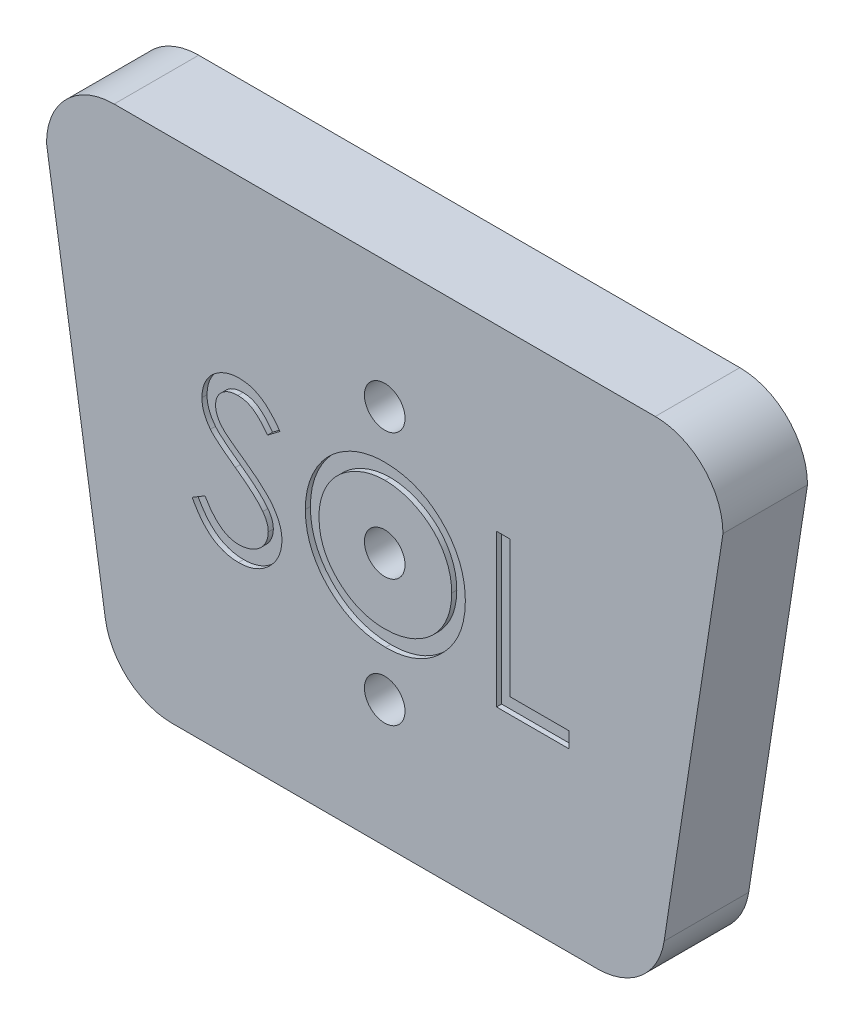
from build123d import *

# Parameters (mm, degrees)
BOSS_EXTRUDE1_DEPTH = 25
FILLET2_R           = 20
SKETCH10_R          = 6
CUT_EXTRUDE6_DEPTH  = 12
SKETCH11_R          = 3.2
CUT_EXTRUDE7_DEPTH  = 251.33777182
CUT_EXTRUDE8_DEPTH  = 1.5


with BuildPart() as part:
    # Sketch2 → Boss-Extrude1 (new body)
    with BuildSketch(Plane.XY):
        with BuildLine():
            Line((0, -20), (20, -150))
            Line((20, -150), (40, -150))
            Line((40, -150), (160, -150))
            Line((160, -150), (180, -150))
            Line((180, -150), (200, -20))
            ThreePointArc((200, -20), (194.142135624, -5.857864376), (180, 0))
            Line((180, 0), (160, 0))
            Line((160, 0), (40, 0))
            Line((40, 0), (20, 0))
            ThreePointArc((20, 0), (5.857864376, -5.857864376), (0, -20))
        make_face()
    extrude(amount=BOSS_EXTRUDE1_DEPTH)

    # Fillet2
    fillet2_edges = [part.edges().sort_by_distance(p)[0] for p in [
        (180, -150, 12.5),
        (20, -150, 12.5),
    ]]
    fillet(fillet2_edges, radius=FILLET2_R)

    # Sketch10 → Cut-Extrude6 (cut)
    with BuildSketch(Plane.XY.offset(25)):
        with Locations((100, -75)):
            Circle(SKETCH10_R)
        with Locations((100, -112.5)):
            Circle(SKETCH10_R)
        with Locations((100, -37.5)):
            Circle(SKETCH10_R)
    extrude(amount=-CUT_EXTRUDE6_DEPTH, mode=Mode.SUBTRACT)

    # Sketch11 → Cut-Extrude7 (cut, through all)
    with BuildSketch(Plane.XY.offset(13)):
        with Locations((100, -37.5)):
            Circle(SKETCH11_R)
        with Locations((100, -75)):
            Circle(SKETCH11_R)
        with Locations((100, -112.5)):
            Circle(SKETCH11_R)
    extrude(amount=-CUT_EXTRUDE7_DEPTH, mode=Mode.SUBTRACT)

    # Sketch13 → Cut-Extrude8 (cut)
    # profile 1 of 3: a face of its own
    with BuildSketch(Plane.XY.offset(25)):
        with BuildLine():
            Line((43.067502305, -89.17305103), (46.871588843, -86.892401992))
            add(Edge.make_bspline(
                [(46.871588843, -86.892401992), (47.225394751, -87.48465837), (47.903273216, -88.619398734), (49.034076405, -90.152716397), (50.205785263, -91.455944127), (51.427076694, -92.521500509), (52.690496027, -93.360414768), (54.004291004, -93.954443461), (55.364034284, -94.324934573), (56.289411989, -94.369935686), (56.751396536, -94.392401992)],
                knots=[0, 0, 0, 0, 1.272034388, 2.437168799, 3.508375237, 4.49857839, 5.41946034, 6.295179144, 7.148887113, 8, 8, 8, 8], degree=3))
            add(Edge.make_bspline(
                [(56.751396536, -94.392401992), (57.145941885, -94.381413345), (57.928128967, -94.359628328), (59.079643519, -94.15030373), (60.197980977, -93.828719215), (61.260092034, -93.368164382), (62.251321363, -92.810955279), (63.120550303, -92.137932997), (63.87200033, -91.384424638), (64.486688946, -90.543790507), (64.9582894, -89.639712882), (65.320758851, -88.711736365), (65.521909798, -87.745283344), (65.552210913, -87.094577393), (65.567502305, -86.766200069)],
                knots=[0, 0, 0, 0, 1.095163259, 2.171163733, 3.241058638, 4.321873601, 5.38011039, 6.391990106, 7.366004449, 8.327778327, 9.272591725, 10.192022065, 11.087607919, 12, 12, 12, 12], degree=3))
            add(Edge.make_bspline(
                [(65.567502305, -86.766200069), (65.548546882, -86.391532001), (65.510013276, -85.629886569), (65.184322818, -84.506176746), (64.671975358, -83.394129417), (64.199312797, -82.706256002), (63.953920574, -82.349132761)],
                knots=[0, 0, 0, 0, 0.938893495, 1.908633276, 2.914225137, 4, 4, 4, 4], degree=3))
            add(Edge.make_bspline(
                [(63.953920574, -82.349132761), (63.752441249, -82.091387886), (63.329460608, -81.550284762), (62.602292589, -80.74484602), (61.749013976, -79.914037776), (60.798825413, -79.026135616), (59.717114271, -78.122435372), (58.537760514, -77.159843227), (57.230653756, -76.174965808), (56.313945943, -75.514461394), (55.840939805, -75.173651992)],
                knots=[0, 0, 0, 0, 0.722233717, 1.516239348, 2.393582979, 3.351407094, 4.387010283, 5.505090956, 6.712668013, 8, 8, 8, 8], degree=3))
            add(Edge.make_bspline(
                [(55.840939805, -75.173651992), (55.367488425, -74.836427294), (54.462285441, -74.191679351), (53.196389382, -73.234795699), (52.064389143, -72.359945948), (51.071316074, -71.558894364), (50.217606971, -70.831532303), (49.496534544, -70.184844514), (48.926467381, -69.601341589), (48.609467059, -69.222810052), (48.467141728, -69.052858723)],
                knots=[0, 0, 0, 0, 1.452282411, 2.77665338, 3.964542531, 5.026858415, 5.96415736, 6.766646006, 7.446254459, 8, 8, 8, 8], degree=3))
            add(Edge.make_bspline(
                [(48.467141728, -69.052858723), (48.268209003, -68.787988249), (47.876981103, -68.267084915), (47.360561033, -67.452908172), (46.921628939, -66.619466188), (46.577541812, -65.764519358), (46.287790427, -64.900070272), (46.092902746, -64.014839971), (45.9708705, -63.11280059), (45.95837353, -62.505769868), (45.952117689, -62.201897184)],
                knots=[0, 0, 0, 0, 1.068054152, 2.10047183, 3.106115577, 4.101338837, 5.06977816, 6.043150881, 7.020423561, 8, 8, 8, 8], degree=3))
            add(Edge.make_bspline(
                [(45.952117689, -62.201897184), (45.968898948, -61.725800083), (46.002102777, -60.78378212), (46.282909428, -59.407671443), (46.726132346, -58.093846079), (47.347066619, -56.855313217), (48.147518299, -55.724322034), (49.073823684, -54.687862916), (50.177114221, -53.816552573), (51.387647949, -53.055254679), (52.712658447, -52.459378498), (54.101112919, -52.009880182), (55.555218131, -51.755189726), (56.540115576, -51.718639891), (57.039858074, -51.7000943)],
                knots=[0, 0, 0, 0, 1.005424448, 1.989358655, 2.955360095, 3.929531133, 4.905563448, 5.876582895, 6.856512386, 7.866279853, 8.892233794, 9.918561126, 10.94386622, 12, 12, 12, 12], degree=3))
            add(Edge.make_bspline(
                [(57.039858074, -51.7000943), (57.570139364, -51.718384249), (58.6246996, -51.75475712), (60.1759038, -52.071011094), (61.669398726, -52.594305446), (62.87081213, -53.18815962), (63.811090492, -53.781277822), (64.528168484, -54.321532705), (65.254821423, -54.943498387), (65.996910699, -55.648831551), (66.741862035, -56.444004065), (67.500734992, -57.323570066), (68.275304162, -58.282154355), (68.773593793, -58.966469365), (69.029040766, -59.3172818)],
                knots=[0, 0, 0, 0, 1.286793592, 2.559021753, 3.825965368, 5.121522368, 5.803751409, 6.523245864, 7.299691795, 8.125521123, 9.008227632, 9.944561021, 10.946284179, 12, 12, 12, 12], degree=3))
            Line((69.029040766, -59.3172818), (65.37819942, -62.084709684))
            add(Edge.make_bspline(
                [(65.37819942, -62.084709684), (65.157751717, -61.800712236), (64.733220983, -61.253799552), (64.088699009, -60.487882637), (63.481216393, -59.788242186), (62.882711253, -59.180547682), (62.324793134, -58.631520254), (61.783288305, -58.161466237), (61.265989504, -57.76578001), (60.613914938, -57.343505668), (59.794687131, -56.924922051), (58.766314522, -56.570719619), (57.691633843, -56.357868822), (56.959681439, -56.329725982), (56.58913692, -56.315478915)],
                knots=[0, 0, 0, 0, 1.181633172, 2.275549214, 3.290209073, 4.226197932, 5.078386478, 5.862611352, 6.581680152, 7.217281963, 8.414376989, 9.595101626, 10.782541182, 12, 12, 12, 12], degree=3))
            add(Edge.make_bspline(
                [(56.58913692, -56.315478915), (56.124267346, -56.331057914), (55.227810165, -56.361100547), (53.955078558, -56.689214644), (52.809585236, -57.205838562), (51.825337971, -57.92988828), (51.005862552, -58.787729615), (50.413078082, -59.774886323), (50.056290252, -60.864945785), (50.012752371, -61.625338509), (49.990579228, -62.0125943)],
                knots=[0, 0, 0, 0, 1.14458467, 2.207223713, 3.21896685, 4.227309161, 5.202851033, 6.127160689, 7.046193047, 8, 8, 8, 8], degree=3))
            add(Edge.make_bspline(
                [(49.990579228, -62.0125943), (49.995633713, -62.253684738), (50.005750949, -62.736259845), (50.146855491, -63.449206699), (50.328132577, -64.160352491), (50.615394985, -64.866499985), (51.01197746, -65.579998887), (51.532758294, -66.313135513), (52.188643734, -67.072371767), (52.691062464, -67.566180858), (52.95632442, -67.826897184)],
                knots=[0, 0, 0, 0, 0.858281714, 1.717966888, 2.583508476, 3.4729293, 4.427298488, 5.488583878, 6.674047936, 8, 8, 8, 8], degree=3))
            add(Edge.make_bspline(
                [(52.95632442, -67.826897184), (53.05482778, -67.914801802), (53.288849214, -68.123643052), (53.716682545, -68.465543803), (54.28166138, -68.887293732), (54.969032538, -69.409130659), (55.791470046, -70.014463743), (56.749064339, -70.695553042), (57.83114119, -71.474508944), (58.598994394, -72.019105894), (59.005002305, -72.307065453)],
                knots=[0, 0, 0, 0, 0.420754252, 0.999615792, 1.744751191, 2.668019286, 3.750313428, 4.999500688, 6.413464383, 8, 8, 8, 8], degree=3))
            add(Edge.make_bspline(
                [(59.005002305, -72.307065453), (59.493392619, -72.662454362), (60.439092772, -73.350615727), (61.784690228, -74.384531613), (63.004753475, -75.395717209), (64.103566092, -76.377715015), (65.091983487, -77.323076211), (65.959039895, -78.243174243), (66.713570071, -79.131417321), (67.525874309, -80.27020758), (68.355903417, -81.66882152), (69.068722798, -83.382398873), (69.518187265, -85.102637279), (69.576963892, -86.258839463), (69.605963843, -86.82930103)],
                knots=[0, 0, 0, 0, 1.163667725, 2.253281268, 3.268753668, 4.215851969, 5.092017293, 5.902905408, 6.650798638, 7.335211899, 8.59617414, 9.77448103, 10.901945474, 12, 12, 12, 12], degree=3))
            add(Edge.make_bspline(
                [(69.605963843, -86.82930103), (69.597514925, -87.232737153), (69.580781159, -88.031774941), (69.388426554, -89.205054501), (69.106602287, -90.344594254), (68.681837851, -91.436308557), (68.163397245, -92.500169792), (67.505545486, -93.508271369), (66.743018111, -94.482925065), (65.868298277, -95.398141382), (64.911136675, -96.238306759), (63.899489173, -96.985680407), (62.831699949, -97.608844564), (61.713561592, -98.117355391), (60.544817263, -98.515072045), (59.325860042, -98.803237505), (58.054680612, -98.980096645), (57.19067442, -98.998453578), (56.751396536, -99.007786607)],
                knots=[0, 0, 0, 0, 0.983748083, 1.948392443, 2.894712957, 3.844097841, 4.80183111, 5.778335162, 6.776009319, 7.81870978, 8.863265674, 9.881300176, 10.883814829, 11.87499822, 12.874611388, 13.892143829, 14.928324115, 16, 16, 16, 16], degree=3))
            add(Edge.make_bspline(
                [(56.751396536, -99.007786607), (56.411513554, -99.001214272), (55.736028068, -98.988152375), (54.736906158, -98.872678769), (53.757968583, -98.709301723), (52.811499242, -98.449920823), (51.88530395, -98.135216833), (50.983410934, -97.747723985), (50.105383099, -97.283359966), (49.246299891, -96.752423936), (48.408346218, -96.134538648), (47.59938163, -95.414879408), (46.79286353, -94.613294344), (46.012597006, -93.708015672), (45.242799437, -92.713668893), (44.498648457, -91.620950821), (43.764740658, -90.435813415), (43.304256072, -89.601833742), (43.067502305, -89.17305103)],
                knots=[0, 0, 0, 0, 0.915332311, 1.819136955, 2.706846663, 3.586547465, 4.459518054, 5.340707479, 6.227863349, 7.133153174, 8.059268498, 9.028702269, 10.047606654, 11.120612155, 12.245963614, 13.433783089, 14.680604001, 16, 16, 16, 16], degree=3))
        make_face()
    # profile 2 of 3: a face of its own
    with BuildSketch(Plane.XY.offset(25)):
        with BuildLine():
            add(Edge.make_bspline(
                [(99.894425382, -51.7000943), (100.727672458, -51.721199034), (102.364238461, -51.762650475), (104.769487146, -52.079953235), (107.0657098, -52.628893963), (109.271611585, -53.359989452), (111.360806998, -54.335260121), (113.34902133, -55.514069171), (115.231523993, -56.908766498), (116.982941756, -58.508570843), (118.585673974, -60.249215251), (119.997721083, -62.10678838), (121.181122002, -64.070058695), (122.152939266, -66.133126518), (122.915349962, -68.291326106), (123.441451952, -70.556163284), (123.777513883, -72.912963585), (123.816802449, -74.520451846), (123.836733074, -75.335911607)],
                knots=[0, 0, 0, 0, 1.065120563, 2.091984664, 3.0946048, 4.079830382, 5.057816894, 6.036188127, 7.030412546, 8.04752943, 9.064399622, 10.05169764, 11.02544977, 11.989514704, 12.962713494, 13.945757189, 14.957906945, 16, 16, 16, 16], degree=3))
            add(Edge.make_bspline(
                [(123.836733074, -75.335911607), (123.81680537, -76.145364489), (123.777525557, -77.740889895), (123.441069846, -80.082734177), (122.913399846, -82.333900274), (122.160019281, -84.490630096), (121.192834558, -86.555198773), (120.001553786, -88.522173894), (118.598309648, -90.392200302), (117.001364421, -92.144791712), (115.26049388, -93.751902049), (113.393247593, -95.152287594), (111.441619194, -96.357312053), (109.380494375, -97.318816433), (107.237208187, -98.087312553), (104.992578319, -98.611274939), (102.657122624, -98.949251209), (101.064495432, -98.9880607), (100.255002305, -99.007786607)],
                knots=[0, 0, 0, 0, 1.043624062, 2.057103931, 3.04512605, 4.022047818, 4.998200453, 5.980619268, 6.982898556, 8.009068085, 9.034988726, 10.034168286, 11.015286542, 11.987931943, 12.962482838, 13.94673481, 14.956375938, 16, 16, 16, 16], degree=3))
            add(Edge.make_bspline(
                [(100.255002305, -99.007786607), (99.439546775, -98.987865919), (97.832066856, -98.94859694), (95.472304972, -98.611978878), (93.205876837, -98.085590687), (91.03926375, -97.333326507), (88.971257512, -96.361104969), (86.997813592, -95.175620095), (85.126853128, -93.768956851), (83.373887816, -92.172529464), (81.769969553, -90.434609509), (80.371634723, -88.572454801), (79.185883266, -86.62259893), (78.216926134, -84.579630763), (77.449811657, -82.4534265), (76.926463995, -80.229803218), (76.587858897, -77.921438143), (76.548839442, -76.349743736), (76.529040766, -75.552257761)],
                knots=[0, 0, 0, 0, 1.053102029, 2.075944431, 3.073151272, 4.055350789, 5.033113405, 6.020478099, 7.024410459, 8.052272461, 9.079885166, 10.07527673, 11.055994387, 12.023226415, 12.992069828, 13.970394897, 14.97016774, 16, 16, 16, 16], degree=3))
            add(Edge.make_bspline(
                [(76.529040766, -75.552257761), (76.535914651, -75.016980587), (76.549575704, -73.953178999), (76.714040322, -72.373465568), (76.952690766, -70.819157111), (77.294715356, -69.294673494), (77.742036789, -67.803746548), (78.269848569, -66.336093883), (78.914503724, -64.906588864), (79.643254913, -63.508459542), (80.456621016, -62.163500752), (81.355023509, -60.892191826), (82.306906818, -59.683864725), (83.350436165, -58.569831818), (84.451219031, -57.517684807), (85.627112465, -56.543592731), (86.870941321, -55.638771933), (88.188057632, -54.823367548), (89.54600688, -54.08589296), (90.945851166, -53.45304059), (92.368578514, -52.909876942), (93.820852559, -52.469637761), (95.298816771, -52.122083013), (96.805696859, -51.885417036), (98.340292339, -51.720532949), (99.374152154, -51.706936495), (99.894425382, -51.7000943)],
                knots=[0, 0, 0, 0, 1.037015668, 2.060948919, 3.074880161, 4.083647147, 5.086022904, 6.090072063, 7.104153813, 8.122640571, 9.144368836, 10.147691507, 11.138137339, 12.123020368, 13.103399296, 14.087645067, 15.080126199, 16.082011238, 17.087798457, 18.072939717, 19.057185487, 20.037253025, 21.01195951, 21.997135196, 22.992090687, 24, 24, 24, 24], degree=3))
        make_face()
        with BuildLine():
            add(Edge.make_bspline(
                [(100.092742689, -56.315478915), (99.665697401, -56.320684647), (98.815689406, -56.331046343), (97.552031083, -56.467534115), (96.304991934, -56.662061259), (95.07431442, -56.939537954), (93.865147842, -57.317590062), (92.666221313, -57.752687453), (91.488467763, -58.282672903), (90.335775305, -58.881464816), (89.218295767, -59.544236655), (88.163846749, -60.276730803), (87.169698469, -61.061769357), (86.238285041, -61.901184409), (85.372341399, -62.799250718), (84.554823808, -63.742353468), (83.818500616, -64.75744921), (83.143686057, -65.817011584), (82.539813825, -66.919660486), (82.002830692, -68.053787286), (81.563579151, -69.228643259), (81.205348598, -70.431482428), (80.90835103, -71.660399766), (80.720200578, -72.924717823), (80.582213099, -74.218083549), (80.572443658, -75.092135958), (80.567502305, -75.534228915)],
                knots=[0, 0, 0, 0, 1.008559885, 2.007477868, 2.99961109, 3.989939068, 4.984837346, 5.991145699, 7.001802488, 8.033829008, 9.059044045, 10.069351652, 11.065060232, 12.050310815, 13.029377138, 14.011219647, 14.996725999, 15.989392538, 16.977580475, 17.965360261, 18.951710183, 19.937753436, 20.929683414, 21.935841486, 22.955955122, 24, 24, 24, 24], degree=3))
            add(Edge.make_bspline(
                [(80.567502305, -75.534228915), (80.583893387, -76.184314611), (80.616139717, -77.463234286), (80.898451333, -79.337396136), (81.33330529, -81.138531246), (81.974328573, -82.856784365), (82.775979332, -84.506925145), (83.766325065, -86.074315062), (84.939656165, -87.559377732), (86.272472935, -88.951745476), (87.729479163, -90.222620102), (89.276614262, -91.338149642), (90.897303501, -92.281995711), (92.59577325, -93.05091807), (94.362955895, -93.660214699), (96.210238694, -94.077797099), (98.125316032, -94.352624383), (99.430710169, -94.379016959), (100.092742689, -94.392401992)],
                knots=[0, 0, 0, 0, 1.032063989, 2.030389145, 3.003944642, 3.970395727, 4.937377036, 5.913328081, 6.909231446, 7.93887556, 8.970685674, 9.976071282, 10.964166581, 11.944589148, 12.933237628, 13.927779006, 14.949070134, 16, 16, 16, 16], degree=3))
            add(Edge.make_bspline(
                [(100.092742689, -94.392401992), (100.537721996, -94.386288364), (101.420249606, -94.374163205), (102.732906322, -94.25203736), (104.021914759, -94.056199039), (105.285466929, -93.774233466), (106.522128789, -93.421340812), (107.737061972, -93.002098596), (108.917325705, -92.479054548), (110.077809334, -91.901152314), (111.188618156, -91.242350288), (112.249017857, -90.534716936), (113.232280455, -89.750834669), (114.162997087, -88.923891365), (115.032495946, -88.037213321), (115.834897171, -87.091953326), (116.567498871, -86.082144876), (117.242057184, -85.024189659), (117.84381342, -83.918523553), (118.368116122, -82.780284837), (118.812923325, -81.612276288), (119.172004102, -80.412813226), (119.453388609, -79.184173742), (119.647273293, -77.924712737), (119.782896076, -76.636949762), (119.793118497, -75.765957328), (119.798271536, -75.326897184)],
                knots=[0, 0, 0, 0, 1.047197238, 2.076906641, 3.100256066, 4.114471768, 5.12198147, 6.126382909, 7.136867548, 8.15857795, 9.17633901, 10.174870724, 11.156907918, 12.133735059, 13.104061851, 14.077631395, 15.04955518, 16.038496417, 17.029181396, 18.010275684, 18.986308667, 19.968651475, 20.955262928, 21.950658345, 22.966943676, 24, 24, 24, 24], degree=3))
            add(Edge.make_bspline(
                [(119.798271536, -75.326897184), (119.793114369, -74.890840701), (119.782884178, -74.025842341), (119.647338076, -72.747060391), (119.453183771, -71.496661958), (119.173377525, -70.279555919), (118.812732691, -69.095432026), (118.368038443, -67.945402412), (117.843656022, -66.825182761), (117.241835994, -65.7375418), (116.565346835, -64.693866597), (115.826135135, -63.696121293), (115.011437802, -62.763043191), (114.144531768, -61.871597124), (113.203763242, -61.040795687), (112.193393747, -60.270363278), (111.125689318, -59.541706894), (109.995196291, -58.884378242), (108.828488315, -58.277338107), (107.631308855, -57.757253781), (106.417220432, -57.315326532), (105.189310416, -56.938394124), (103.937243552, -56.663148022), (102.669480038, -56.46735881), (101.387773856, -56.331093848), (100.525789603, -56.32070041), (100.092742689, -56.315478915)],
                knots=[0, 0, 0, 0, 1.02996197, 2.043119294, 3.035359645, 4.018872909, 4.991431989, 5.957985074, 6.929999688, 7.912076566, 8.892894881, 9.867085534, 10.843653904, 11.817741046, 12.803660682, 13.806313499, 14.818574707, 15.856120519, 16.894564902, 17.924820532, 18.937903209, 19.946497019, 20.957711757, 21.963978472, 22.977135795, 24, 24, 24, 24], degree=3))
        make_face(mode=Mode.SUBTRACT)
    # profile 3 of 3: a face of its own
    with BuildSketch(Plane.XY.offset(25)):
        Polygon((133.067502305, -52.853940453), (137.105963843, -52.853940453), (137.105963843, -93.238555838), (154.413656151, -93.238555838), (154.413656151, -97.853940453), (133.067502305, -97.853940453), align=None)
    extrude(amount=-CUT_EXTRUDE8_DEPTH, mode=Mode.SUBTRACT)


solid = part.part
